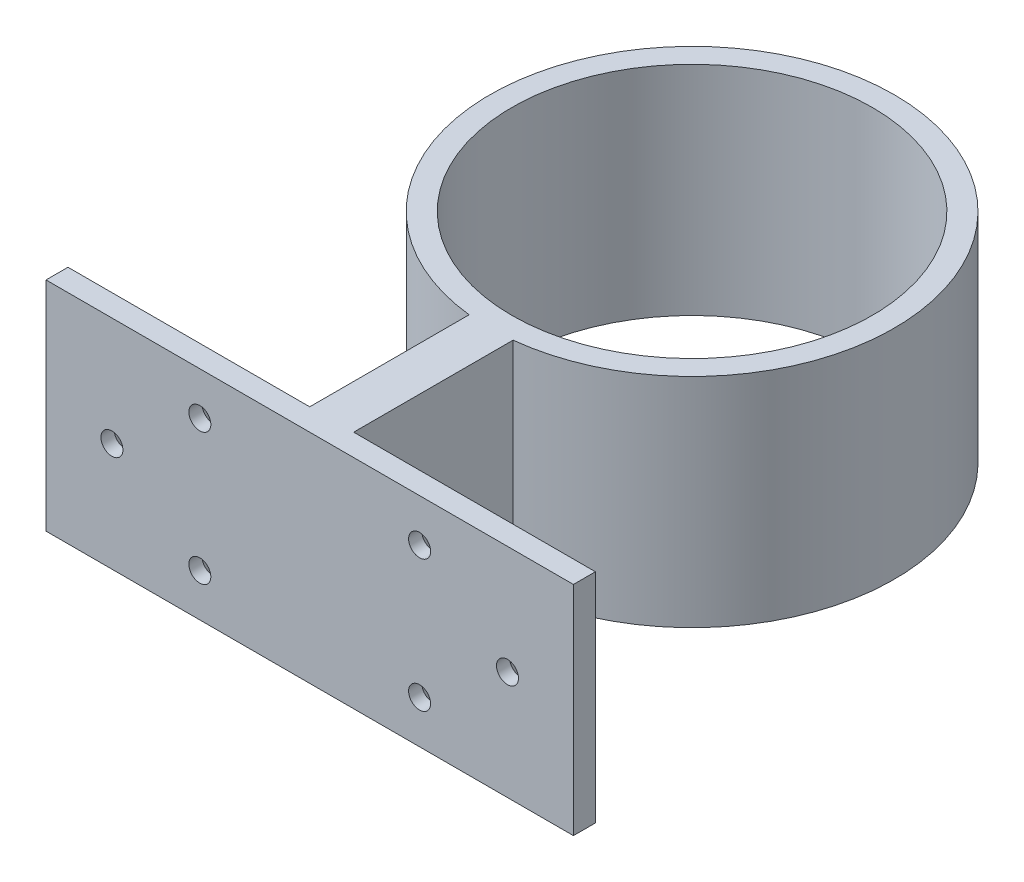
from build123d import *

# Parameters (mm, degrees)
SKETCH3_R           = 41
BOSS_EXTRUDE1_DEPTH = 24.75
SKETCH4_R           = 2.5
CUT_EXTRUDE1_DEPTH  = 30
CHAMFER1_SIZE       = 2


with BuildPart() as part:
    # Sketch3 → Boss-Extrude1 (new, symmetric)
    with BuildSketch(Plane(origin=(0, 0, 0), x_dir=(1, 0, 0), z_dir=(0, 1, 0))):
        with BuildLine():
            Line((5, -82), (60, -82))
            Line((60, -82), (60, -87))
            Line((60, -87), (-60, -87))
            Line((-60, -87), (-60, -82))
            Line((-60, -82), (-5, -82))
            Line((-5, -82), (-5, -45.727453461))
            ThreePointArc((-5, -45.727453461), (0, 46), (5, -45.727453461))
            Line((5, -45.727453461), (5, -82))
        make_face()
        with Locations(Location((0, 0, 0), (0, 0, 270))):
            Circle(SKETCH3_R, mode=Mode.SUBTRACT)
    extrude(amount=BOSS_EXTRUDE1_DEPTH, both=True)

    # Sketch4 → Cut-Extrude1 (cut)
    with BuildSketch(Plane.XY.offset(87)):
        with Locations((-25, 15)):
            Circle(SKETCH4_R)
        with Locations((-45, 0)):
            Circle(SKETCH4_R)
        with Locations((-25, -15)):
            Circle(SKETCH4_R)
        with Locations((25, -15)):
            Circle(SKETCH4_R)
        with Locations((45, 0)):
            Circle(SKETCH4_R)
        with Locations((25, 15)):
            Circle(SKETCH4_R)
    extrude(amount=-CUT_EXTRUDE1_DEPTH, mode=Mode.SUBTRACT)

    # Chamfer1
    chamfer1_edges = [part.edges().sort_by_distance(p)[0] for p in [
        (-47.5, 0, 82),
        (-27.5, 15, 82),
        (-27.5, -15, 82),
        (22.5, 15, 82),
        (22.5, -15, 82),
        (42.5, 0, 82),
    ]]
    chamfer(chamfer1_edges, length=CHAMFER1_SIZE)


solid = part.part
